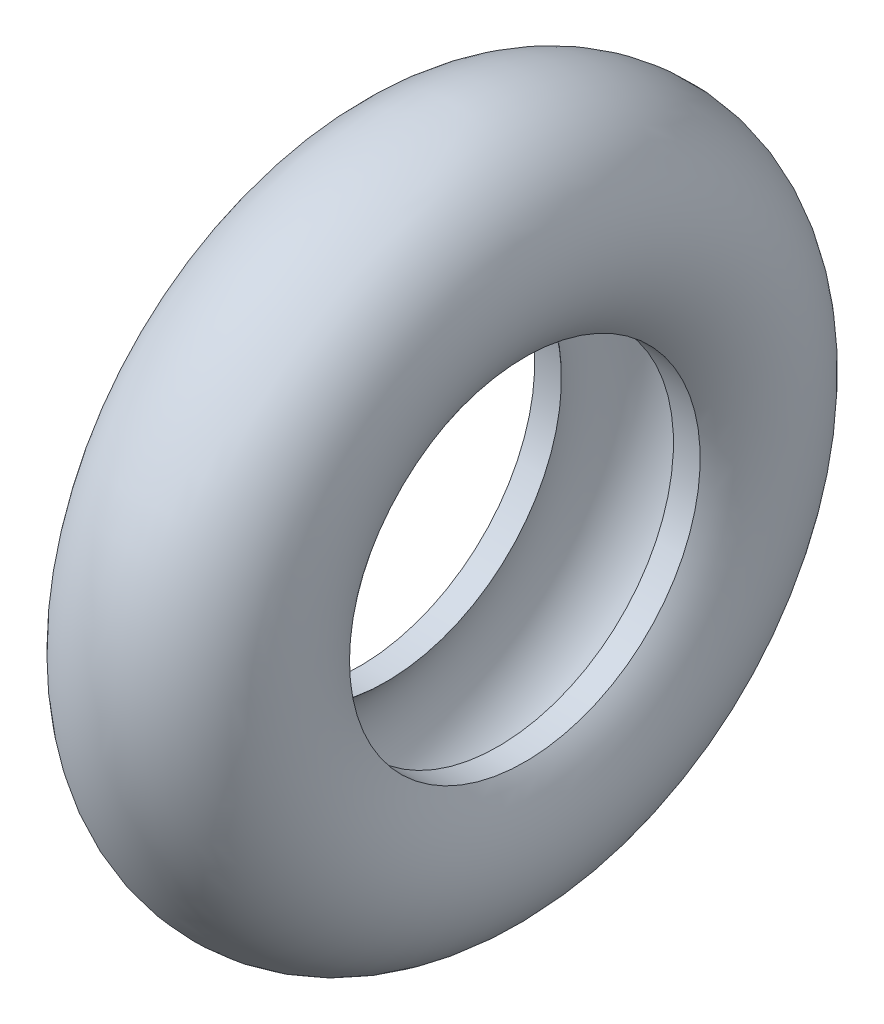
from build123d import *


with BuildPart() as part:
    # Esquisse1 → Révolution1 (revolve)
    with BuildSketch(Plane.XY, mode=Mode.PRIVATE) as r_volution1_sk:
        with BuildLine():
            Line((-43.623957191, 92.448078907), (-29.528793423, 92.448078907))
            ThreePointArc((-29.528793423, 92.448078907), (0, 174.995), (29.528793423, 92.448078907))
            Line((29.528793423, 92.448078907), (43.623957191, 92.448078907))
            ThreePointArc((43.623957191, 92.448078907), (0, 184.995), (-43.623957191, 92.448078907))
        make_face()
    revolve(r_volution1_sk.sketch.rotate(Axis((-106.608138565, 0, 0), (1, 0, 0)), 90), axis=Axis((-106.608138565, 0, 0), (1, 0, 0)))


solid = part.part
